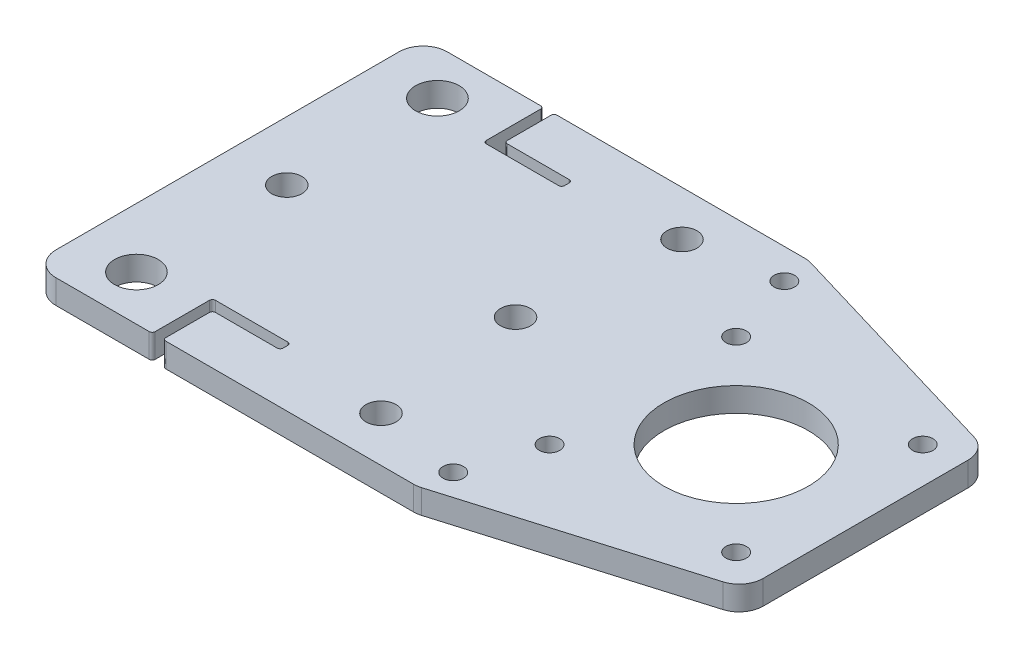
from build123d import *

# Parameters (mm, degrees)
SKETCH1_R           = 12
BOSS_EXTRUDE1_DEPTH = 2
SKETCH2_R           = 1.7
CUT_EXTRUDE1_DEPTH  = 91.622844802
SKETCH3_R           = 2.5
SKETCH3_R_2         = 3.625
CUT_EXTRUDE2_DEPTH  = 91.622844802
CUT_EXTRUDE3_DEPTH  = 91.622844802
FILLET1_R           = 4
FILLET2_R           = 0.5


with BuildPart() as part:
    # Sketch1 → Boss-Extrude1 (new, symmetric)
    with BuildSketch(Plane(origin=(0, 0, 0), x_dir=(1, 0, 0), z_dir=(0, 1, 0))):
        Polygon((21.5, 20), (21.5, -20), (-20.5, -32.5), (-84.5, -32.5), (-84.5, 32.5), (-20.5, 32.5), align=None)
        with Locations(Location((0, 0, 0), (0, 0, 270))):
            Circle(SKETCH1_R, mode=Mode.SUBTRACT)
    extrude(amount=BOSS_EXTRUDE1_DEPTH, both=True)

    # Sketch2 → Cut-Extrude1 (cut, through all)
    with BuildSketch(Plane(origin=(0, 2, 0), x_dir=(1, 0, 0), z_dir=(0, 1, 0))):
        with Locations(Location((15.5, 15.5, 0), (0, 0, 270))):
            Circle(SKETCH2_R)
        with Locations(Location((-15.5, 15.5, 0), (0, 0, 270))):
            Circle(SKETCH2_R)
        with Locations(Location((-15.5, -15.5, 0), (0, 0, 270))):
            Circle(SKETCH2_R)
        with Locations(Location((15.5, -15.5, 0), (0, 0, 270))):
            Circle(SKETCH2_R)
        with Locations(Location((-19.5, 27.5, 0), (0, 0, 270))):
            Circle(SKETCH2_R)
        with Locations(Location((-19.5, -27.5, 0), (0, 0, 270))):
            Circle(SKETCH2_R)
    extrude(amount=-CUT_EXTRUDE1_DEPTH, mode=Mode.SUBTRACT)

    # Sketch3 → Cut-Extrude2 (cut, through all)
    with BuildSketch(Plane(origin=(0, 2, 0), x_dir=(1, 0, 0), z_dir=(0, 1, 0))):
        with Locations(Location((-74.65, 0, 0), (0, 0, 270))):
            Circle(SKETCH3_R)
        with Locations(Location((-36.65, 0, 0), (0, 0, 270))):
            Circle(SKETCH3_R)
        with Locations(Location((-34, 25, 0), (0, 0, 270))):
            Circle(SKETCH3_R)
        with Locations(Location((-34, -25, 0), (0, 0, 270))):
            Circle(SKETCH3_R)
        with Locations(Location((-74.625, 25, 0), (0, 0, 270))):
            Circle(SKETCH3_R_2)
        with Locations(Location((-74.625, -25, 0), (0, 0, 270))):
            Circle(SKETCH3_R_2)
    extrude(amount=-CUT_EXTRUDE2_DEPTH, mode=Mode.SUBTRACT)

    # Sketch4 → Cut-Extrude3 (cut, through all)
    with BuildSketch(Plane(origin=(0, 2, 0), x_dir=(1, 0, 0), z_dir=(0, 1, 0))):
        Polygon((-64.5, 32.5), (-64.5, 22.5), (-51.5, 22.5), (-51.5, 24.25), (-62.75, 24.25), (-62.75, 32.5), align=None)
        Polygon((-62.75, -24.25), (-62.75, -32.5), (-64.5, -32.5), (-64.5, -22.5), (-51.5, -22.5), (-51.5, -24.25), align=None)
    extrude(amount=-CUT_EXTRUDE3_DEPTH, mode=Mode.SUBTRACT)

    # Fillet1
    fillet1_edges = [part.edges().sort_by_distance(p)[0] for p in [
        (-20.5, 0, 32.5),
        (-84.5, 0, 32.5),
        (-84.5, 0, -32.5),
        (-20.5, 0, -32.5),
        (21.5, 0, -20),
        (21.5, 0, 20),
    ]]
    fillet(fillet1_edges, radius=FILLET1_R)

    # Fillet2
    fillet2_edges = [part.edges().sort_by_distance(p)[0] for p in [
        (-62.75, 0, 24.25),
        (-62.75, 0, 32.5),
        (-64.5, 0, 32.5),
        (-64.5, 0, 22.5),
        (-51.5, 0, 22.5),
        (-64.5, 0, -32.5),
        (-62.75, 0, -32.5),
        (-62.75, 0, -24.25),
        (-51.5, 0, -24.25),
        (-51.5, 0, -22.5),
        (-64.5, 0, -22.5),
        (-51.5, 0, 24.25),
    ]]
    fillet(fillet2_edges, radius=FILLET2_R)


solid = part.part
